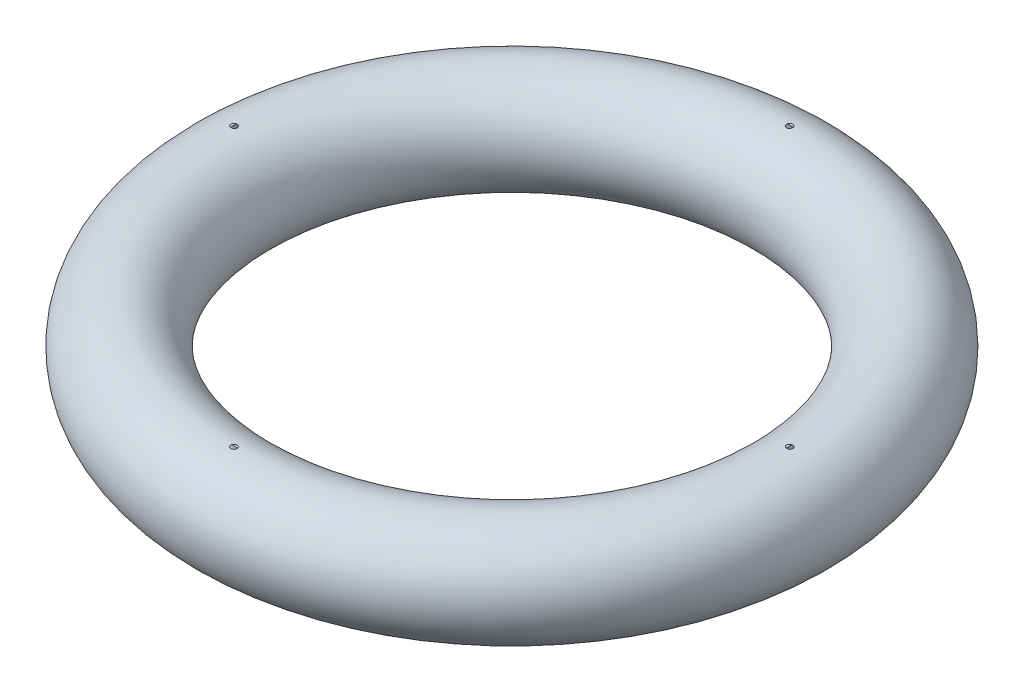
from build123d import *
from build123d.topology import SkipClean

# Parameters (mm, degrees)
SKETCH83_R                     = 6.35
SKETCH83_R_2                   = 5.969
F_2_0MM_DOWEL_HOLE1_AT_2_COUNT = 2
F_2_0MM_DOWEL_HOLE1_AT_2_PITCH = 48.224682477
F_2_0MM_DOWEL_HOLE1_AT_3_COUNT = 2
F_2_0MM_DOWEL_HOLE1_AT_3_PITCH = 68.2
F_2_0MM_DOWEL_HOLE1_AT_4_COUNT = 2
F_2_0MM_DOWEL_HOLE1_AT_4_PITCH = 48.224682477


with BuildPart() as part:
    # Sketch83 → Revolve2 (revolve)
    with BuildSketch(Plane.XY, mode=Mode.PRIVATE) as revolve2_sk:
        with Locations((-34.1, 0)):
            Circle(SKETCH83_R)
        with Locations((-34.1, 0)):
            Circle(SKETCH83_R_2, mode=Mode.SUBTRACT)
    revolve(revolve2_sk.sketch.rotate(Axis((0, 14.113315056, 0), (0, -1, 0)), 270), axis=Axis((0, 14.113315056, 0), (0, -1, 0)))

    # Sketch88 → Ø2.0mm Dowel Hole1 (revolve, cut)
    with BuildSketch(Plane(origin=(-34.1, 5.95, 0), x_dir=(0, 0, -1), z_dir=(1, 0, 0))):
        Polygon((0, 0), (0, 0.620860619), (1, 0.02), (1, 0), align=None)
    f_2_0mm_dowel_hole1 = revolve(axis=Axis((-34.1, -0.4, 0), (0, 1, 0)), mode=Mode.SUBTRACT)

    # Ø2.0mm Dowel Hole1 at 2: Ø2.0mm Dowel Hole1 ×2
    with Locations(*[Vector(0.7071067811865488, 0, -0.7071067811865462) * (i * F_2_0MM_DOWEL_HOLE1_AT_2_PITCH) for i in range(1, F_2_0MM_DOWEL_HOLE1_AT_2_COUNT)]):
        add(f_2_0mm_dowel_hole1, mode=Mode.SUBTRACT)

    # Ø2.0mm Dowel Hole1 at 3: Ø2.0mm Dowel Hole1 ×2
    with SkipClean():  # the faces are left unmerged after this step: merging them gives an invalid solid
        with Locations(*[(i * F_2_0MM_DOWEL_HOLE1_AT_3_PITCH, 0, 0) for i in range(1, F_2_0MM_DOWEL_HOLE1_AT_3_COUNT)]):
            add(f_2_0mm_dowel_hole1, mode=Mode.SUBTRACT)

    # Ø2.0mm Dowel Hole1 at 4: Ø2.0mm Dowel Hole1 ×2
    with SkipClean():  # the faces are left unmerged after this step: merging them gives an invalid solid
        with Locations(*[Vector(0.707106781186544, 0, 0.7071067811865512) * (i * F_2_0MM_DOWEL_HOLE1_AT_4_PITCH) for i in range(1, F_2_0MM_DOWEL_HOLE1_AT_4_COUNT)]):
            add(f_2_0mm_dowel_hole1, mode=Mode.SUBTRACT)


solid = part.part
